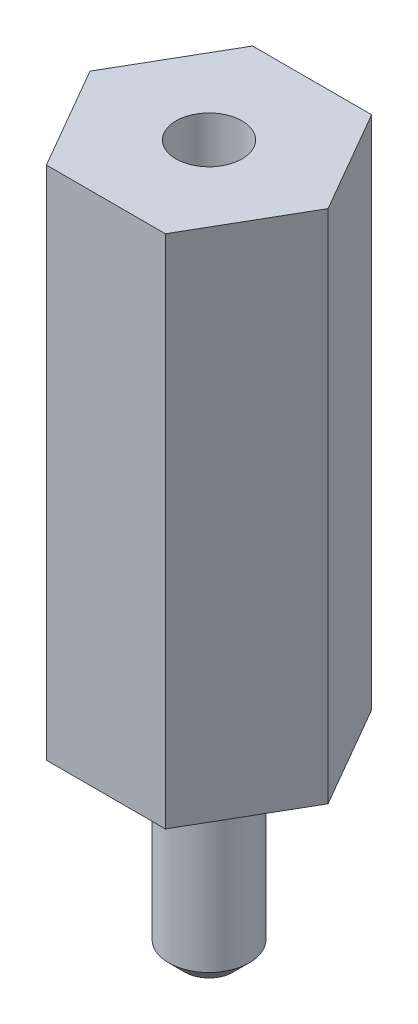
from build123d import *

# Parameters (mm, degrees)
BOSS_EXTRUDE1_DEPTH     = 16
M2_5_TAPPED_HOLE1_D     = 2.05
M2_5_TAPPED_HOLE1_DEPTH = 6.35
M2_5_TAPPED_HOLE1_TIP   = 0.615882135
SKETCH3_R               = 1.25
BOSS_EXTRUDE2_DEPTH     = 6
CHAMFER1_SIZE           = 0.5


with BuildPart() as part:
    # Sketch1 → Boss-Extrude1 (new body)
    with BuildSketch(Plane(origin=(0, 0, 0), x_dir=(1, 0, 0), z_dir=(0, 1, 0))):
        Polygon((3.695041723, 0), (1.847520861, 3.2), (-1.847520861, 3.2), (-3.695041723, 0), (-1.847520861, -3.2), (1.847520861, -3.2), align=None)
    extrude(amount=BOSS_EXTRUDE1_DEPTH)

    # M2.5 Tapped Hole1
    with Locations(Plane.ZX.offset(16)):
        with Locations((0, 0)):
            Hole(M2_5_TAPPED_HOLE1_D / 2, depth=M2_5_TAPPED_HOLE1_DEPTH)
            with Locations((0, 0, -(M2_5_TAPPED_HOLE1_DEPTH + M2_5_TAPPED_HOLE1_TIP / 2))):  # 118° drill point
                Cone(0, M2_5_TAPPED_HOLE1_D / 2, M2_5_TAPPED_HOLE1_TIP, mode=Mode.SUBTRACT)

    # Sketch3 → Boss-Extrude2 (add)
    with BuildSketch(Plane.XZ):
        with Locations(Location((0, 0, 0), (0, 0, 270))):
            Circle(SKETCH3_R)
    extrude(amount=BOSS_EXTRUDE2_DEPTH)

    # Chamfer1
    chamfer1_edges = [part.edges().sort_by_distance(p)[0] for p in [
        (0, -6, 1.25),
    ]]
    chamfer(chamfer1_edges, length=CHAMFER1_SIZE)


solid = part.part
